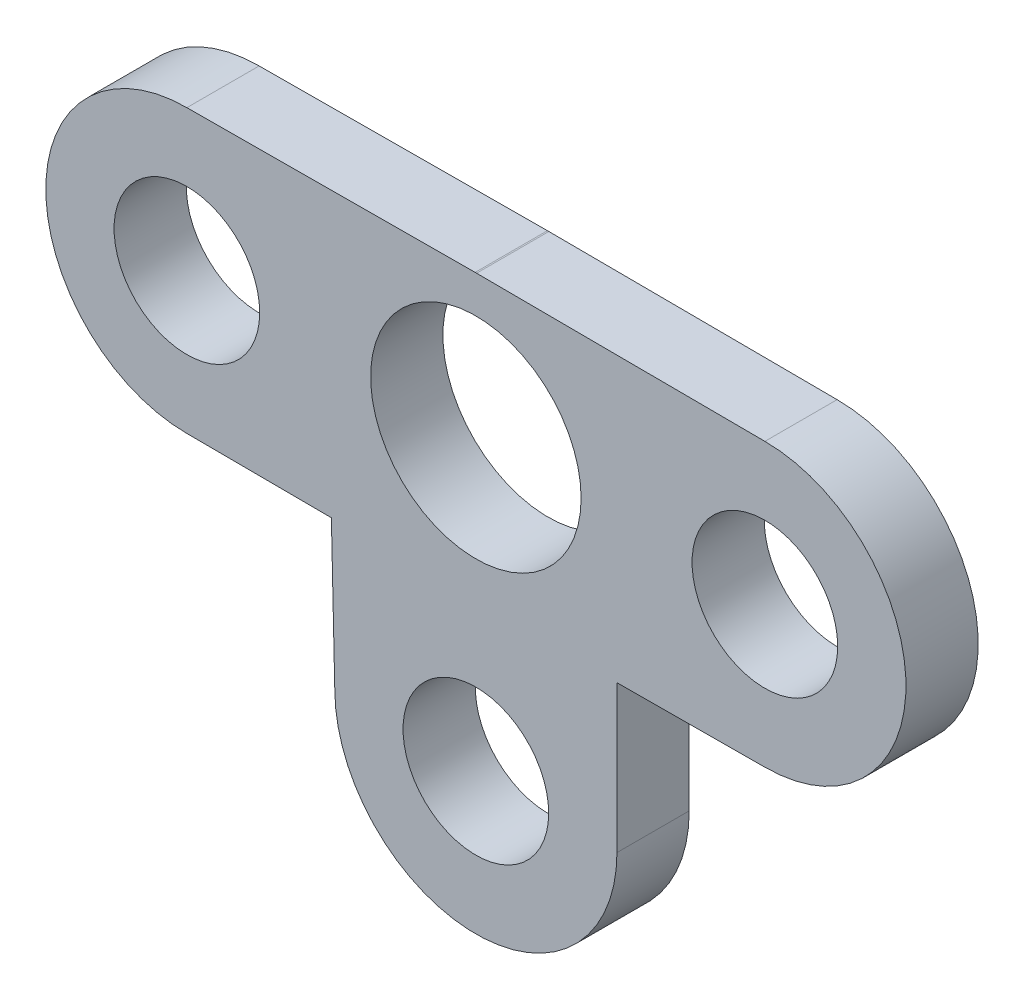
from build123d import *

# Parameters (mm, degrees)
SKETCH3_R           = 3.2
SKETCH3_R_2         = 4.625
BOSS_EXTRUDE1_DEPTH = 3.175


with BuildPart() as part:
    # Sketch3 → Boss-Extrude1 (new body)
    with BuildSketch(Plane.XY):
        with BuildLine():
            Line((0, 6.265082263), (-12.7, 6.2))
            ThreePointArc((-12.7, 6.2), (-18.9, 0), (-12.7, -6.2))
            Line((-12.7, -6.2), (-6.35, -6.232541132))
            Line((-6.35, -6.232541132), (-6.2, -12.7))
            ThreePointArc((-6.2, -12.7), (0, -18.9), (6.2, -12.7))
            Line((6.2, -12.7), (6.2, -6.23330982))
            Line((6.2, -6.23330982), (12.7, -6.2))
            ThreePointArc((12.7, -6.2), (18.9, 0), (12.7, 6.2))
            Line((12.7, 6.2), (0, 6.265082263))
        make_face()
        with Locations((-12.7, 0)):
            Circle(SKETCH3_R, mode=Mode.SUBTRACT)
        with Locations((12.7, 0)):
            Circle(SKETCH3_R, mode=Mode.SUBTRACT)
        Circle(SKETCH3_R_2, mode=Mode.SUBTRACT)
        with Locations((0, -12.7)):
            Circle(SKETCH3_R, mode=Mode.SUBTRACT)
    extrude(amount=BOSS_EXTRUDE1_DEPTH)


solid = part.part
